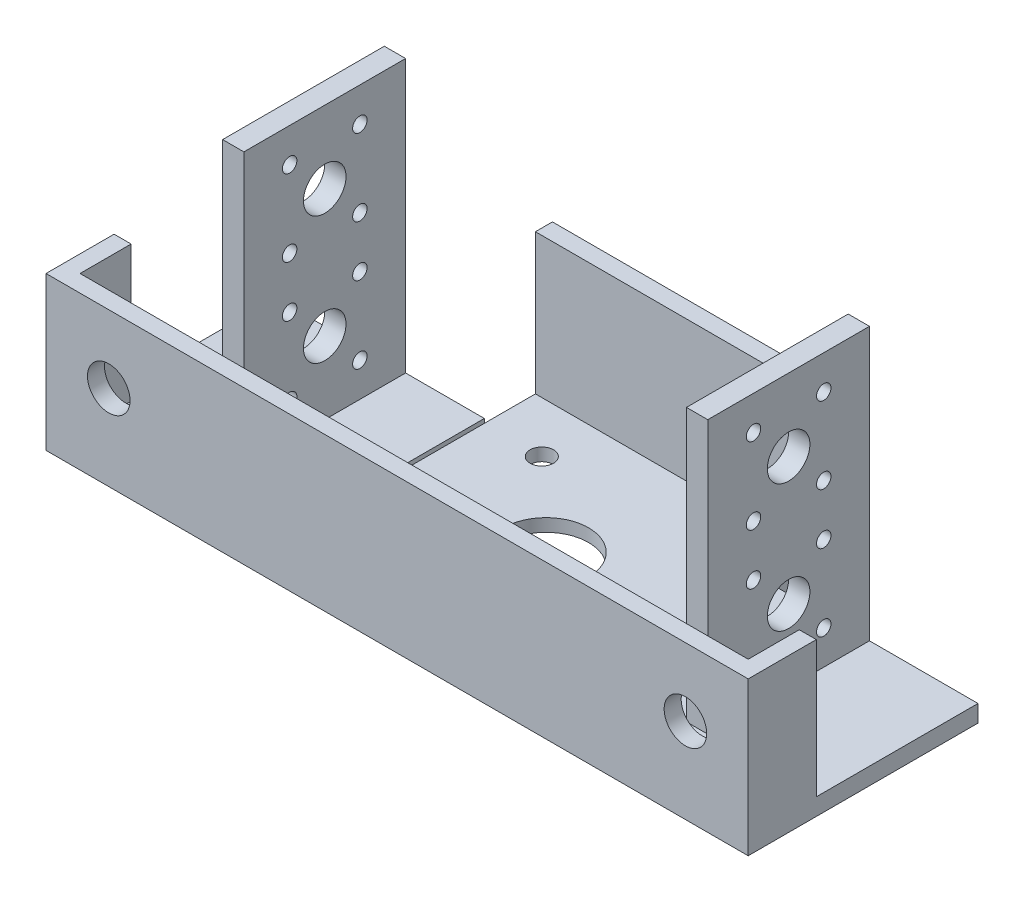
from build123d import *

# Parameters (mm, degrees)
SKETCH1_W                 = 75
SKETCH1_H                 = 40
SKETCH1_R                 = 5
SKETCH1_R_2               = 1.7
SKETCH1_W_2               = 10
SKETCH1_H_2               = 20
BOSS_EXTRUDE1_DEPTH       = 3
CUT_EXTRUDE1_DEPTH        = 43.605750786
CUT_EXTRUDE1_DEPTH_BACK   = 43.605750786
SKETCH2_W                 = 67
SKETCH2_H                 = 28
BOSS_EXTRUDE3_DEPTH       = 110
BOSS_EXTRUDE3_DEPTH_BACK  = 3
SKETCH6_W                 = 67
SKETCH6_H                 = 11
CUT_EXTRUDE4_DEPTH        = 122.372360939
SKETCH7_W                 = 70
SKETCH7_H                 = 37
BOSS_EXTRUDE4_DEPTH       = 45
SKETCH8_W                 = 45
SKETCH8_H                 = 62
CUT_EXTRUDE6_DEPTH        = 29
SKETCH11_W                = 45
SKETCH11_H                = 4
CUT_EXTRUDE9_DEPTH        = 157.445677473
SKETCH9_W                 = 38
SKETCH9_H                 = 28.5
CUT_EXTRUDE10_DEPTH       = 204.024629048
SKETCH13_W                = 5
SKETCH13_H                = 38
BOSS_EXTRUDE5_DEPTH       = 32
SKETCH14_R                = 5
SKETCH14_R_2              = 1.7
CUT_EXTRUDE11_DEPTH       = 32
SKETCH15_W                = 165
SKETCH15_H                = 70
SKETCH15_W_2              = 157
SKETCH15_H_2              = 62
BOSS_EXTRUDE6_DEPTH       = 3
SKETCH16_W                = 20
SKETCH16_H                = 4.820648258
CUT_EXTRUDE12_DEPTH       = 159.626132778
SKETCH18_R                = 5
CUT_EXTRUDE14_DEPTH       = 159.626132778
MIRROR6_COPY_1_SKETCH_W   = 5
MIRROR6_COPY_1_SKETCH_H   = 38
MIRROR6_COPY_1_DEPTH      = 32
MIRROR6_COPY_2_SKETCH_R   = 5
MIRROR6_COPY_2_SKETCH_R_2 = 1.7
MIRROR6_COPY_2_DEPTH      = 32
SKETCH19_W                = 38
SKETCH19_H                = 3.5
CUT_EXTRUDE15_DEPTH       = 10
SKETCH20_R                = 1.2
CUT_EXTRUDE16_DEPTH       = 10
SKETCH21_W                = 10
SKETCH21_H                = 80
CUT_EXTRUDE17_DEPTH       = 184.330984833
SKETCH22_W                = 55
SKETCH22_H                = 80
CUT_EXTRUDE18_DEPTH       = 184.330984833
SKETCH23_W                = 67
SKETCH23_H                = 62
BOSS_EXTRUDE7_DEPTH       = 3
SKETCH24_R                = 10
SKETCH24_R_2              = 2.75
CUT_EXTRUDE19_DEPTH       = 111.707949127
CUT_EXTRUDE21_START       = -16
SKETCH25_R                = 5
CUT_EXTRUDE21_DEPTH       = 16


with BuildPart() as part:
    # Sketch1 → Boss-Extrude1 (new body)
    with BuildSketch(Plane(origin=(0, 0, 0), x_dir=(1, 0, 0), z_dir=(0, 1, 0))):
        Rectangle(SKETCH1_W, SKETCH1_H)
        with Locations(Location((-21, 0, 0), (0, 0, 270))):
            Circle(SKETCH1_R, mode=Mode.SUBTRACT)
        with Locations(Location((-30, 8.25, 0), (0, 0, 270))):
            Circle(SKETCH1_R_2, mode=Mode.SUBTRACT)
        with Locations(Location((-12, 8.25, 0), (0, 0, 270))):
            Circle(SKETCH1_R_2, mode=Mode.SUBTRACT)
        with Locations(Location((-12, -8.25, 0), (0, 0, 270))):
            Circle(SKETCH1_R_2, mode=Mode.SUBTRACT)
        with Locations(Location((-30, -8.25, 0), (0, 0, 270))):
            Circle(SKETCH1_R_2, mode=Mode.SUBTRACT)
        with Locations(Location((12, 8.25, 0), (0, 0, 90))):
            Circle(SKETCH1_R_2, mode=Mode.SUBTRACT)
        with Locations(Location((12, -8.25, 0), (0, 0, 90))):
            Circle(SKETCH1_R_2, mode=Mode.SUBTRACT)
        with Locations(Location((21, 0, 0), (0, 0, 90))):
            Circle(SKETCH1_R, mode=Mode.SUBTRACT)
        with Locations(Location((30, -8.25, 0), (0, 0, 90))):
            Circle(SKETCH1_R_2, mode=Mode.SUBTRACT)
        with Locations(Location((30, 8.25, 0), (0, 0, 90))):
            Circle(SKETCH1_R_2, mode=Mode.SUBTRACT)
        Rectangle(SKETCH1_W_2, SKETCH1_H_2, mode=Mode.SUBTRACT)
    extrude(amount=BOSS_EXTRUDE1_DEPTH)

    # Sketch2 → Cut-Extrude1 (cut, two sides: drawn at the far end of the back side and taken through both)
    with BuildSketch(Plane(origin=(0, 3, 0), x_dir=(1, 0, 0), z_dir=(0, 1, 0)).offset(-CUT_EXTRUDE1_DEPTH_BACK)):
        Rectangle(SKETCH2_W, SKETCH2_H)
    extrude(amount=CUT_EXTRUDE1_DEPTH + CUT_EXTRUDE1_DEPTH_BACK, mode=Mode.SUBTRACT)

    # Sketch3 → Boss-Extrude3 (add, two sides: drawn at the far end of the back side and taken through both)
    with BuildSketch(Plane(origin=(0, 3, 0), x_dir=(1, 0, 0), z_dir=(0, 1, 0)).offset(-BOSS_EXTRUDE3_DEPTH_BACK)):
        Polygon((37.5, -35), (37.5, -20), (33.5, -20), (-33.5, -20), (-37.5, -20), (-37.5, -35), align=None)
        Polygon((33.5, 20), (37.5, 20), (37.5, 35), (-37.5, 35), (-37.5, 20), (-33.5, 20), align=None)
        Polygon((37.5, -20), (37.5, 20), (33.5, 20), (33.5, 14), (33.5, -14), (33.5, -20), align=None)
        Polygon((-33.5, 14), (-33.5, 20), (-37.5, 20), (-37.5, -20), (-33.5, -20), (-33.5, -14), align=None)
    extrude(amount=BOSS_EXTRUDE3_DEPTH + BOSS_EXTRUDE3_DEPTH_BACK)

    # Sketch6 → Cut-Extrude4 (cut, through all)
    with BuildSketch(Plane(origin=(0, 3, 0), x_dir=(1, 0, 0), z_dir=(0, 1, 0))):
        with Locations((0, -25.5)):
            Rectangle(SKETCH6_W, SKETCH6_H)
        with Locations((0, 25.5)):
            Rectangle(SKETCH6_W, SKETCH6_H)
    extrude(amount=CUT_EXTRUDE4_DEPTH, mode=Mode.SUBTRACT)

    # Sketch7 → Boss-Extrude4 (add)
    with BuildSketch(Plane.ZY.offset(37.5)):
        with Locations((0, 94.5)):
            Rectangle(SKETCH7_W, SKETCH7_H)
    boss_extrude4 = extrude(amount=BOSS_EXTRUDE4_DEPTH)

    # Mirror2: Boss-Extrude4 across plane
    add(boss_extrude4.mirror(Plane(origin=(0, 0, 0), x_dir=(0, 0, 1), z_dir=(1, 0, 0))))

    # Sketch8 → Cut-Extrude6 (cut)
    with BuildSketch(Plane(origin=(0, 113, 0), x_dir=(1, 0, 0), z_dir=(0, 1, 0))):
        with Locations((-56, 0)):
            Rectangle(SKETCH8_W, SKETCH8_H)
        with Locations((56, 0)):
            Rectangle(SKETCH8_W, SKETCH8_H)
    extrude(amount=-CUT_EXTRUDE6_DEPTH, mode=Mode.SUBTRACT)

    # Sketch11 → Cut-Extrude9 (cut, through all)
    with BuildSketch(Plane.XY.offset(35)):
        with Locations((-60, 78)):
            Rectangle(SKETCH11_W, SKETCH11_H)
        with Locations((60, 78)):
            Rectangle(SKETCH11_W, SKETCH11_H)
    extrude(amount=-CUT_EXTRUDE9_DEPTH, mode=Mode.SUBTRACT)

    # Sketch9 → Cut-Extrude10 (cut, through all)
    with BuildSketch(Plane.ZY.offset(82.5)):
        with Locations((0, 98.25)):
            Rectangle(SKETCH9_W, SKETCH9_H)
    extrude(amount=-CUT_EXTRUDE10_DEPTH, mode=Mode.SUBTRACT)

    # Sketch13 → Boss-Extrude5 (add)
    with BuildSketch(Plane(origin=(0, 84, 0), x_dir=(1, 0, 0), z_dir=(0, 1, 0))):
        with Locations((-54.5, 0)):
            Rectangle(SKETCH13_W, SKETCH13_H)
    boss_extrude5 = extrude(amount=BOSS_EXTRUDE5_DEPTH)

    # Sketch14 → Cut-Extrude11 (cut)
    with BuildSketch(Plane.ZY.offset(57)):
        with Locations((0, 101)):
            Circle(SKETCH14_R)
        with Locations((-8.25, 110)):
            Circle(SKETCH14_R_2)
        with Locations((8.25, 110)):
            Circle(SKETCH14_R_2)
        with Locations((8.25, 92)):
            Circle(SKETCH14_R_2)
        with Locations((-8.25, 92)):
            Circle(SKETCH14_R_2)
    cut_extrude11 = extrude(amount=-CUT_EXTRUDE11_DEPTH, mode=Mode.SUBTRACT)

    # Mirror4: Boss-Extrude5, Cut-Extrude11 across plane
    add(boss_extrude5.mirror(Plane(origin=(0, 0, 0), x_dir=(0, 0, 1), z_dir=(1, 0, 0))))
    add(cut_extrude11.mirror(Plane(origin=(0, 0, 0), x_dir=(0, 0, 1), z_dir=(1, 0, 0))), mode=Mode.SUBTRACT)

    # Sketch15 → Boss-Extrude6 (add)
    with BuildSketch(Plane(origin=(0, 113, 0), x_dir=(1, 0, 0), z_dir=(0, 1, 0))):
        Rectangle(SKETCH15_W, SKETCH15_H)
        Rectangle(SKETCH15_W_2, SKETCH15_H_2, mode=Mode.SUBTRACT)
    extrude(amount=BOSS_EXTRUDE6_DEPTH)

    # Sketch16 → Cut-Extrude12 (cut, through all)
    with BuildSketch(Plane.XY.offset(35)):
        with Locations((0, 11.636111214)):
            Rectangle(SKETCH16_W, SKETCH16_H)
    extrude(amount=-CUT_EXTRUDE12_DEPTH, mode=Mode.SUBTRACT)

    # Sketch18 → Cut-Extrude14 (cut, through all)
    with BuildSketch(Plane.XY.offset(35)):
        with Locations((67.75, 100)):
            Circle(SKETCH18_R)
    cut_extrude14 = extrude(amount=-CUT_EXTRUDE14_DEPTH, mode=Mode.SUBTRACT)

    # Mirror5: Cut-Extrude14 across plane
    add(cut_extrude14.mirror(Plane(origin=(0, 0, 0), x_dir=(0, 0, 1), z_dir=(1, 0, 0))), mode=Mode.SUBTRACT)

    # Mirror6: Boss-Extrude5, Cut-Extrude11 across plane
    add(boss_extrude5.mirror(Plane.ZX.offset(116)))
    add(cut_extrude11.mirror(Plane.ZX.offset(116)), mode=Mode.SUBTRACT)

    # Mirror6 copy 1 sketch → Mirror6 copy 1 (add)
    with BuildSketch(Plane(origin=(0, 148, 0), x_dir=(-1, 0, 0), z_dir=(0, -1, 0))):
        with Locations((-54.5, 0)):
            Rectangle(MIRROR6_COPY_1_SKETCH_W, MIRROR6_COPY_1_SKETCH_H)
    extrude(amount=MIRROR6_COPY_1_DEPTH)

    # Mirror6 copy 2 sketch → Mirror6 copy 2 (cut)
    with BuildSketch(Plane(origin=(57, 232, 0), x_dir=(0, 0, 1), z_dir=(1, 0, 0))):
        with Locations((0, 101)):
            Circle(MIRROR6_COPY_2_SKETCH_R)
        with Locations((-8.25, 110)):
            Circle(MIRROR6_COPY_2_SKETCH_R_2)
        with Locations((8.25, 110)):
            Circle(MIRROR6_COPY_2_SKETCH_R_2)
        with Locations((8.25, 92)):
            Circle(MIRROR6_COPY_2_SKETCH_R_2)
        with Locations((-8.25, 92)):
            Circle(MIRROR6_COPY_2_SKETCH_R_2)
    extrude(amount=-MIRROR6_COPY_2_DEPTH, mode=Mode.SUBTRACT)

    # Sketch19 → Cut-Extrude15 (cut)
    with BuildSketch(Plane(origin=(82.5, 0, 0), x_dir=(0, 0, -1), z_dir=(1, 0, 0))):
        with Locations((0, 114.25)):
            Rectangle(SKETCH19_W, SKETCH19_H)
    cut_extrude15 = extrude(amount=-CUT_EXTRUDE15_DEPTH, mode=Mode.SUBTRACT)

    # Mirror7: Cut-Extrude15 across plane
    add(cut_extrude15.mirror(Plane(origin=(0, 0, 0), x_dir=(0, 0, 1), z_dir=(1, 0, 0))), mode=Mode.SUBTRACT)

    # Sketch20 → Cut-Extrude16 (cut)
    with BuildSketch(Plane(origin=(0, 3, 0), x_dir=(1, 0, 0), z_dir=(0, 1, 0))):
        with Locations(Location((-24, 17.5, 0), (0, 0, 270))):
            Circle(SKETCH20_R)
        with Locations(Location((-12, 17.5, 0), (0, 0, 270))):
            Circle(SKETCH20_R)
        with Locations(Location((12, 17.5, 0), (0, 0, 270))):
            Circle(SKETCH20_R)
        with Locations(Location((-24, -17.5, 0), (0, 0, 270))):
            Circle(SKETCH20_R)
        with Locations(Location((-12, -17.5, 0), (0, 0, 270))):
            Circle(SKETCH20_R)
        with Locations(Location((24, 17.5, 0), (0, 0, 270))):
            Circle(SKETCH20_R)
        with Locations(Location((12, -17.5, 0), (0, 0, 270))):
            Circle(SKETCH20_R)
        with Locations(Location((24, -17.5, 0), (0, 0, 270))):
            Circle(SKETCH20_R)
    extrude(amount=-CUT_EXTRUDE16_DEPTH, mode=Mode.SUBTRACT)

    # Sketch21 → Cut-Extrude17 (cut, through all)
    with BuildSketch(Plane.XY.offset(35)):
        with Locations((32.5, 40)):
            Rectangle(SKETCH21_W, SKETCH21_H)
        with Locations((-32.5, 40)):
            Rectangle(SKETCH21_W, SKETCH21_H)
    extrude(amount=-CUT_EXTRUDE17_DEPTH, mode=Mode.SUBTRACT)

    # Sketch22 → Cut-Extrude18 (cut, through all)
    with BuildSketch(Plane.XY.offset(35)):
        with Locations((0, 40)):
            Rectangle(SKETCH22_W, SKETCH22_H)
    extrude(amount=-CUT_EXTRUDE18_DEPTH, mode=Mode.SUBTRACT)

    # Sketch23 → Boss-Extrude7 (add)
    with BuildSketch(Plane.XZ.offset(-80)):
        Rectangle(SKETCH23_W, SKETCH23_H)
    extrude(amount=-BOSS_EXTRUDE7_DEPTH)

    # Sketch24 → Cut-Extrude19 (cut, through all)
    with BuildSketch(Plane(origin=(0, 83, 0), x_dir=(1, 0, 0), z_dir=(0, 1, 0))):
        with Locations(Location((0, 0, 0), (0, 0, 270))):
            Circle(SKETCH24_R)
        with Locations(Location((-20, 19, 0), (0, 0, 270))):
            Circle(SKETCH24_R_2)
        with Locations(Location((-20, -19, 0), (0, 0, 270))):
            Circle(SKETCH24_R_2)
        with Locations(Location((20, -19, 0), (0, 0, 90))):
            Circle(SKETCH24_R_2)
        with Locations(Location((20, 19, 0), (0, 0, 90))):
            Circle(SKETCH24_R_2)
    extrude(amount=-CUT_EXTRUDE19_DEPTH, mode=Mode.SUBTRACT)

    # Sketch25 → Cut-Extrude21 (cut)
    with BuildSketch(Plane(origin=(0, 0, -35), x_dir=(-1, 0, 0), z_dir=(0, 0, -1)).offset(CUT_EXTRUDE21_START)):
        Polygon((33.5, 116), (33.5, 84), (33.5, 80), (82.5, 80), (82.5, 116), align=None)
        with Locations((67.75, 100)):
            Circle(SKETCH25_R, mode=Mode.SUBTRACT)
    cut_extrude21 = extrude(amount=CUT_EXTRUDE21_DEPTH, mode=Mode.SUBTRACT)

    # Mirror8: Cut-Extrude21 across plane
    add(cut_extrude21.mirror(Plane(origin=(0, 0, 0), x_dir=(0, 0, 1), z_dir=(1, 0, 0))), mode=Mode.SUBTRACT)


solid = part.part
